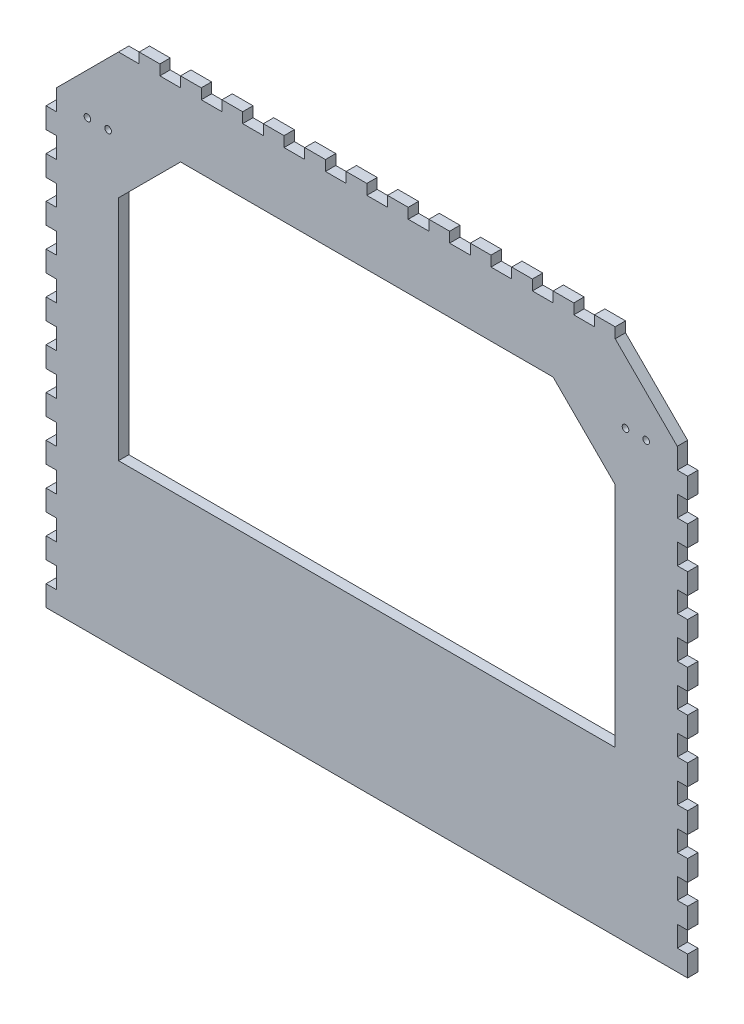
from build123d import *

# Parameters (mm, degrees)
SKIZZE1_R                       = 1.6
AUFSATZ_LINEAR_AUSTRAGEN1_DEPTH = 5


with BuildPart() as part:
    # Skizze1 → Aufsatz-Linear austragen1 (new body)
    with BuildSketch(Plane.XY):
        Polygon((5, 10), (5, 20), (0, 20), (0, 30), (5, 30), (5, 40), (0, 40), (0, 50), (5, 50), (5, 60), (0, 60), (0, 70), (5, 70), (5, 80), (0, 80), (0, 90), (5, 90), (5, 100), (0, 100), (0, 110), (5, 110), (5, 120), (0, 120), (0, 130), (5, 130), (5, 140), (0, 140), (0, 150), (5, 150), (5, 160), (0, 160), (0, 170), (5, 170), (5, 180), (0, 180), (0, 190), (5, 190), (5, 200), (0, 200), (0, 210), (5, 210), (5, 220), (35, 250), (45, 250), (45, 255), (55, 255), (55, 250), (65, 250), (65, 255), (75, 255), (75, 250), (85, 250), (85, 255), (95, 255), (95, 250), (105, 250), (105, 255), (115, 255), (115, 250), (125, 250), (125, 255), (135, 255), (135, 250), (145, 250), (145, 255), (155, 255), (155, 250), (165, 250), (165, 255), (175, 255), (175, 250), (185, 250), (185, 255), (195, 255), (195, 250), (205, 250), (205, 255), (215, 255), (215, 250), (225, 250), (225, 255), (235, 255), (235, 250), (245, 250), (245, 255), (255, 255), (255, 250), (265, 250), (265, 255), (275, 255), (275, 250), (305, 220), (305, 210), (310, 210), (310, 200), (305, 200), (305, 190), (310, 190), (310, 180), (305, 180), (305, 170), (310, 170), (310, 160), (305, 160), (305, 150), (310, 150), (310, 140), (305, 140), (305, 130), (310, 130), (310, 120), (305, 120), (305, 110), (310, 110), (310, 100), (305, 100), (305, 90), (310, 90), (310, 80), (305, 80), (305, 70), (310, 70), (310, 60), (305, 60), (305, 50), (310, 50), (310, 40), (305, 40), (305, 30), (310, 30), (310, 20), (305, 20), (305, 10), (310, 10), (310, 0), (305, 0), (5, 0), (0, 0), (0, 10), align=None)
        with Locations((290, 214.999999999)):
            Circle(SKIZZE1_R, mode=Mode.SUBTRACT)
        with Locations((280, 214.999999999)):
            Circle(SKIZZE1_R, mode=Mode.SUBTRACT)
        with Locations((20, 215)):
            Circle(SKIZZE1_R, mode=Mode.SUBTRACT)
        with Locations((30, 215)):
            Circle(SKIZZE1_R, mode=Mode.SUBTRACT)
        Polygon((275, 188.971165398), (245, 218.971165398), (65, 218.971165398), (35, 188.971165398), (35, 78.971165398), (275, 78.971165398), align=None, mode=Mode.SUBTRACT)
    extrude(amount=AUFSATZ_LINEAR_AUSTRAGEN1_DEPTH)


solid = part.part
